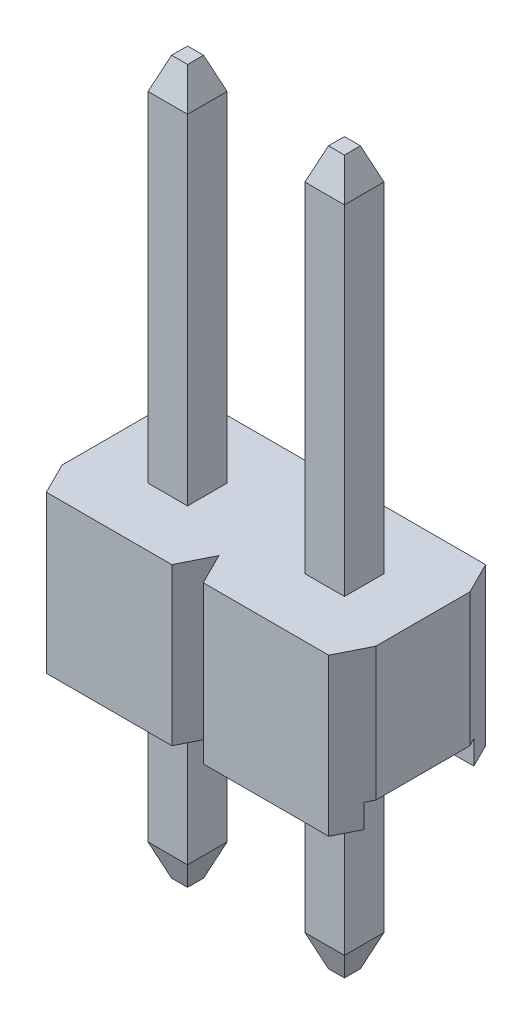
from build123d import *
from OCP.BRepFilletAPI import BRepFilletAPI_MakeChamfer

# Parameters (mm, degrees)
SKETCH1_W                     = 2.54
SKETCH1_H                     = 2.54
MAIN_BODY_DEPTH               = 2.54
SKETCH3_W                     = 1.778
SKETCH3_H                     = 0.381
CUT_EXTRUDE1_DEPTH            = 5.399409051
CUT_EXTRUDE2_DEPTH            = 5.399409051
BODY_PATTERN_COUNT            = 2
BODY_PATTERN_PITCH            = 2.54
PIN_START                     = -5.54
SKETCH2_W                     = 0.64
SKETCH2_H                     = 0.64
PIN_DEPTH                     = 11.54
CHAMFER1_SIZE                 = 0.508
CHAMFER1_SIZE2                = 0.1905
CHAMFER2_SIZE                 = 0.1905
CHAMFER2_SIZE2                = 0.508
PIN_PATTERN_COUNT             = 2
PIN_PATTERN_PITCH             = 2.54
CHAMFER1_OF_PIN_PATTERN_SIZE  = 0.508
CHAMFER1_OF_PIN_PATTERN_SIZE2 = 0.1905
CHAMFER2_OF_PIN_PATTERN_SIZE2 = 0.1905
CHAMFER2_OF_PIN_PATTERN_SIZE  = 0.508


with BuildPart() as part:
    # Sketch1 → Main Body (new body)
    with BuildSketch(Plane(origin=(0, 0, 0), x_dir=(1, 0, 0), z_dir=(0, 1, 0))):
        with Locations((1.27, 1.27)):
            Rectangle(SKETCH1_W, SKETCH1_H)
    main_body = extrude(amount=MAIN_BODY_DEPTH)

    # Sketch3 → Cut-Extrude1 (cut, through all)
    with BuildSketch(Plane.ZY):
        with Locations((-1.27, 0.1905)):
            Rectangle(SKETCH3_W, SKETCH3_H)
    cut_extrude1 = extrude(amount=-CUT_EXTRUDE1_DEPTH, mode=Mode.SUBTRACT)

    # Sketch4 → Cut-Extrude2 (cut, through all)
    with BuildSketch(Plane(origin=(0, 2.54, 0), x_dir=(1, 0, 0), z_dir=(0, 1, 0))):
        Polygon((0.254, 2.54), (0, 2.54), (0, 2.032), align=None)
        Polygon((2.54, 2.54), (2.286, 2.54), (2.54, 2.032), align=None)
        Polygon((0.254, 0), (0, 0.508), (0, 0), align=None)
        Polygon((2.54, 0), (2.286, 0), (2.54, 0.508), align=None)
    cut_extrude2 = extrude(amount=-CUT_EXTRUDE2_DEPTH, mode=Mode.SUBTRACT)

    # Body Pattern: Main Body, Cut-Extrude1, Cut-Extrude2 ×2
    with Locations(*[(-i * BODY_PATTERN_PITCH, 0, 0) for i in range(1, BODY_PATTERN_COUNT)]):
        add(main_body)
        add(cut_extrude1, mode=Mode.SUBTRACT)
        add(cut_extrude2, mode=Mode.SUBTRACT)

    # Sketch2 → Pin (add)
    with BuildSketch(Plane(origin=(0, 2.54, 0), x_dir=(1, 0, 0), z_dir=(0, 1, 0)).offset(PIN_START)):
        with Locations((1.27, 1.27)):
            Rectangle(SKETCH2_W, SKETCH2_H)
    pin = extrude(amount=PIN_DEPTH)

    # Chamfer1: one chamfer whose edges measure the first distance from different faces: ONE call of the kernel's chamfer builder (chamfer() names one face for all edges)
    chamfer1_edges_1 = [part.edges().sort_by_distance(p)[0] for p in [
        (0.95, 8.54, -1.27),
    ]]
    chamfer1_side_1 = [part.faces().sort_by_distance(p)[0] for p in [
        (0.95, 5.54, -1.27),
    ]]
    chamfer1_edges_2 = [part.edges().sort_by_distance(p)[0] for p in [
        (1.27, 8.54, -0.95),
    ]]
    chamfer1_side_2 = [part.faces().sort_by_distance(p)[0] for p in [
        (1.27, 5.54, -0.95),
    ]]
    chamfer1_edges_3 = [part.edges().sort_by_distance(p)[0] for p in [
        (1.59, 8.54, -1.27),
    ]]
    chamfer1_side_3 = [part.faces().sort_by_distance(p)[0] for p in [
        (1.59, 5.54, -1.27),
    ]]
    chamfer1_edges_4 = [part.edges().sort_by_distance(p)[0] for p in [
        (1.27, 8.54, -1.59),
    ]]
    chamfer1_side_4 = [part.faces().sort_by_distance(p)[0] for p in [
        (1.27, 5.54, -1.59),
    ]]
    chamfer1 = BRepFilletAPI_MakeChamfer(part.part.solid().wrapped)
    for e in chamfer1_edges_1:
        chamfer1.Add(CHAMFER1_SIZE, CHAMFER1_SIZE2, e.wrapped, chamfer1_side_1[0].wrapped)  # the first distance lies on this face
    for e in chamfer1_edges_2:
        chamfer1.Add(CHAMFER1_SIZE, CHAMFER1_SIZE2, e.wrapped, chamfer1_side_2[0].wrapped)  # the first distance lies on this face
    for e in chamfer1_edges_3:
        chamfer1.Add(CHAMFER1_SIZE, CHAMFER1_SIZE2, e.wrapped, chamfer1_side_3[0].wrapped)  # the first distance lies on this face
    for e in chamfer1_edges_4:
        chamfer1.Add(CHAMFER1_SIZE, CHAMFER1_SIZE2, e.wrapped, chamfer1_side_4[0].wrapped)  # the first distance lies on this face
    add(Compound.cast(chamfer1.Shape()), mode=Mode.REPLACE)

    # Chamfer2
    chamfer2_edges = [part.edges().sort_by_distance(p)[0] for p in [
        (1.27, -3, -0.95),
        (1.59, -3, -1.27),
        (1.27, -3, -1.59),
        (0.95, -3, -1.27),
    ]]
    chamfer2_side = [part.faces().sort_by_distance(p)[0] for p in [
        (1.27, -3, -1.27),
    ]]
    chamfer(chamfer2_edges, length=CHAMFER2_SIZE, length2=CHAMFER2_SIZE2, reference=chamfer2_side[0])

    # Pin Pattern: Pin ×2
    with Locations(*[(-i * PIN_PATTERN_PITCH, 0, 0) for i in range(1, PIN_PATTERN_COUNT)]):
        add(pin)

    # Chamfer1 of Pin Pattern: one chamfer whose edges measure the first distance from different faces: ONE call of the kernel's chamfer builder (chamfer() names one face for all edges)
    chamfer1_of_pin_pattern_edges_1 = [part.edges().sort_by_distance(p)[0] for p in [
        (-1.59, 8.54, -1.27),
    ]]
    chamfer1_of_pin_pattern_side_1 = [part.faces().sort_by_distance(p)[0] for p in [
        (-1.59, 5.54, -1.27),
    ]]
    chamfer1_of_pin_pattern_edges_2 = [part.edges().sort_by_distance(p)[0] for p in [
        (-1.27, 8.54, -0.95),
    ]]
    chamfer1_of_pin_pattern_side_2 = [part.faces().sort_by_distance(p)[0] for p in [
        (-1.27, 5.54, -0.95),
    ]]
    chamfer1_of_pin_pattern_edges_3 = [part.edges().sort_by_distance(p)[0] for p in [
        (-0.95, 8.54, -1.27),
    ]]
    chamfer1_of_pin_pattern_side_3 = [part.faces().sort_by_distance(p)[0] for p in [
        (-0.95, 5.54, -1.27),
    ]]
    chamfer1_of_pin_pattern_edges_4 = [part.edges().sort_by_distance(p)[0] for p in [
        (-1.27, 8.54, -1.59),
    ]]
    chamfer1_of_pin_pattern_side_4 = [part.faces().sort_by_distance(p)[0] for p in [
        (-1.27, 5.54, -1.59),
    ]]
    chamfer1_of_pin_pattern = BRepFilletAPI_MakeChamfer(part.part.solid().wrapped)
    for e in chamfer1_of_pin_pattern_edges_1:
        chamfer1_of_pin_pattern.Add(CHAMFER1_OF_PIN_PATTERN_SIZE, CHAMFER1_OF_PIN_PATTERN_SIZE2, e.wrapped, chamfer1_of_pin_pattern_side_1[0].wrapped)  # the first distance lies on this face
    for e in chamfer1_of_pin_pattern_edges_2:
        chamfer1_of_pin_pattern.Add(CHAMFER1_OF_PIN_PATTERN_SIZE, CHAMFER1_OF_PIN_PATTERN_SIZE2, e.wrapped, chamfer1_of_pin_pattern_side_2[0].wrapped)  # the first distance lies on this face
    for e in chamfer1_of_pin_pattern_edges_3:
        chamfer1_of_pin_pattern.Add(CHAMFER1_OF_PIN_PATTERN_SIZE, CHAMFER1_OF_PIN_PATTERN_SIZE2, e.wrapped, chamfer1_of_pin_pattern_side_3[0].wrapped)  # the first distance lies on this face
    for e in chamfer1_of_pin_pattern_edges_4:
        chamfer1_of_pin_pattern.Add(CHAMFER1_OF_PIN_PATTERN_SIZE, CHAMFER1_OF_PIN_PATTERN_SIZE2, e.wrapped, chamfer1_of_pin_pattern_side_4[0].wrapped)  # the first distance lies on this face
    add(Compound.cast(chamfer1_of_pin_pattern.Shape()), mode=Mode.REPLACE)

    # Chamfer2 of Pin Pattern
    chamfer2_of_pin_pattern_edges = [part.edges().sort_by_distance(p)[0] for p in [
        (-1.27, -3, -0.95),
        (-0.95, -3, -1.27),
        (-1.27, -3, -1.59),
        (-1.59, -3, -1.27),
    ]]
    chamfer(chamfer2_of_pin_pattern_edges, length=CHAMFER2_OF_PIN_PATTERN_SIZE, length2=CHAMFER2_OF_PIN_PATTERN_SIZE2)


solid = part.part
